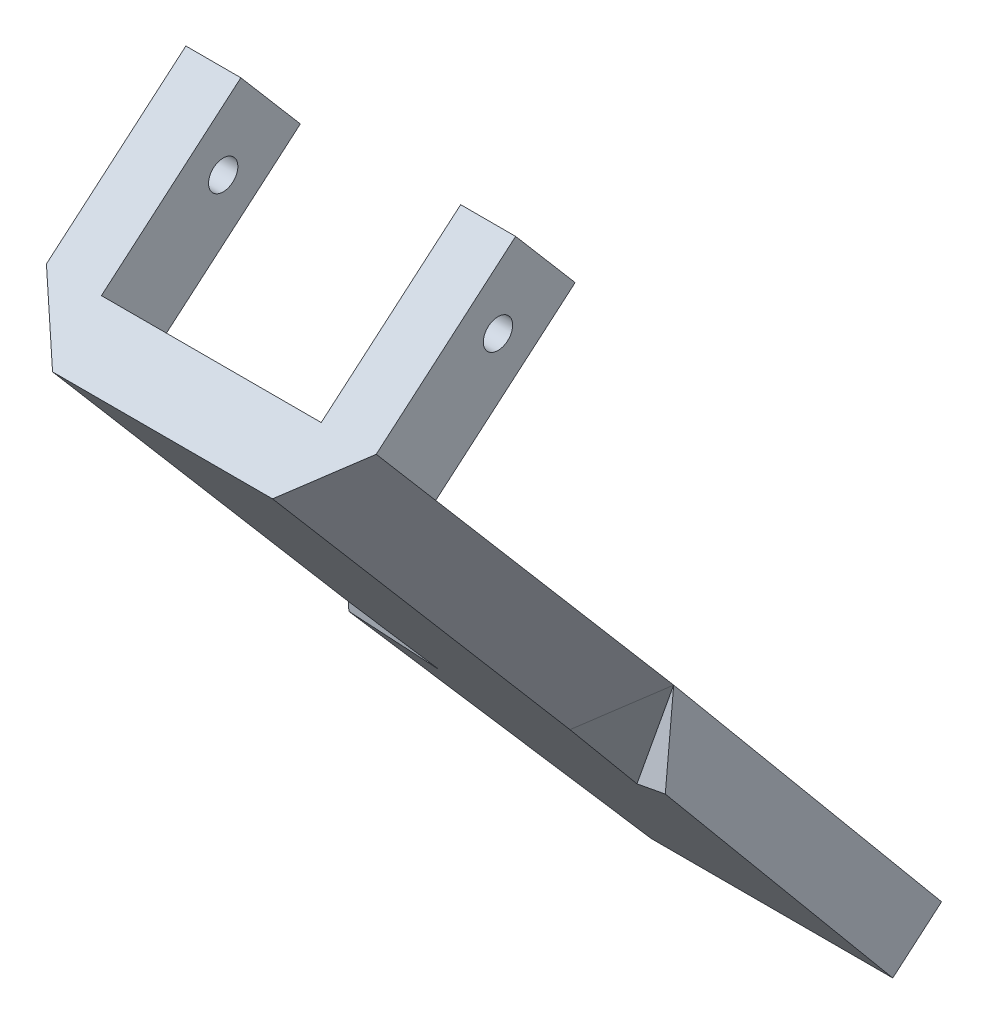
from build123d import *

# Parameters (mm, degrees)
BOSS_EXTRUDE1_DEPTH = 8.89
SKETCH9_W           = 38.1
SKETCH9_H           = 121.867408042
CUT_EXTRUDE1_DEPTH  = 10.16
BOSS_EXTRUDE2_DEPTH = 63.5
SKETCH12_W          = 7.62
SKETCH12_H          = 12.7
BOSS_EXTRUDE3_DEPTH = 25.4
SKETCH13_R          = 2.031999992
CUT_EXTRUDE2_DEPTH  = 192.096705726


with BuildPart() as part:
    # Sketch2 → Boss-Extrude1 (new body)
    with BuildSketch(Plane(origin=(0, 56.279110665, -65.958580335), x_dir=(1, 0, 0), z_dir=(-2.6819765335530572e-15, -0.6490822674547435, 0.7607182198921023))):
        Polygon((-16.72668145, 3.22686704), (-22.849895735, 69.859735371), (22.849895735, 69.859735371), (16.72668145, 3.22686704), align=None)
    extrude(amount=BOSS_EXTRUDE1_DEPTH)

    # Sketch9 → Cut-Extrude1 (cut)
    with BuildSketch(Plane(origin=(33.190173949, 20.761268326, -19.633059225), x_dir=(0.48578044214566346, 0.04870063464806599, 0.8727231005385612), z_dir=(-0.757838639718343, -0.4740466672810366, 0.44828601739246093))):
        with Locations((-4.711274375, 41.231357985)):
            Rectangle(SKETCH9_W, SKETCH9_H)
    cut_extrude1 = extrude(amount=CUT_EXTRUDE1_DEPTH, mode=Mode.SUBTRACT)

    # Mirror1: Cut-Extrude1 across plane
    add(cut_extrude1.mirror(Plane.ZY), mode=Mode.SUBTRACT)

    # Sketch11 → Boss-Extrude2 (add)
    with BuildSketch(Plane(origin=(0, 53.143573534, 45.344715438), x_dir=(1, 0, 0), z_dir=(3.7947063652272325e-15, 0.7607182198921023, 0.6490822674547434))):
        Polygon((-22.849895735, 86.70566658), (-15.24, 77.81566658), (15.24, 77.81566658), (22.849895735, 86.70566658), align=None)
    extrude(amount=BOSS_EXTRUDE2_DEPTH)

    # Sketch12 → Boss-Extrude3 (add)
    with BuildSketch(Plane(origin=(0, 56.279110665, -65.958580335), x_dir=(-1, 0, 0), z_dir=(2.6000297763106772e-15, 0.6490822674547435, -0.7607182198921024))):
        with Locations((-19.039895735, 127.009735371)):
            Rectangle(SKETCH12_W, SKETCH12_H)
    boss_extrude3 = extrude(amount=BOSS_EXTRUDE3_DEPTH)

    # Mirror2: Boss-Extrude3 across plane
    add(boss_extrude3.mirror(Plane(origin=(0, 0, 0), x_dir=(0, 0, 1), z_dir=(1, 0, 0))))

    # Sketch13 → Cut-Extrude2 (cut, through all)
    with BuildSketch(Plane.ZY.offset(22.849895735)):
        with Locations(Location((3.72850645, 163.778945597, 0), (0, 0, 270))):
            Circle(SKETCH13_R)
    extrude(amount=-CUT_EXTRUDE2_DEPTH, mode=Mode.SUBTRACT)


solid = part.part
